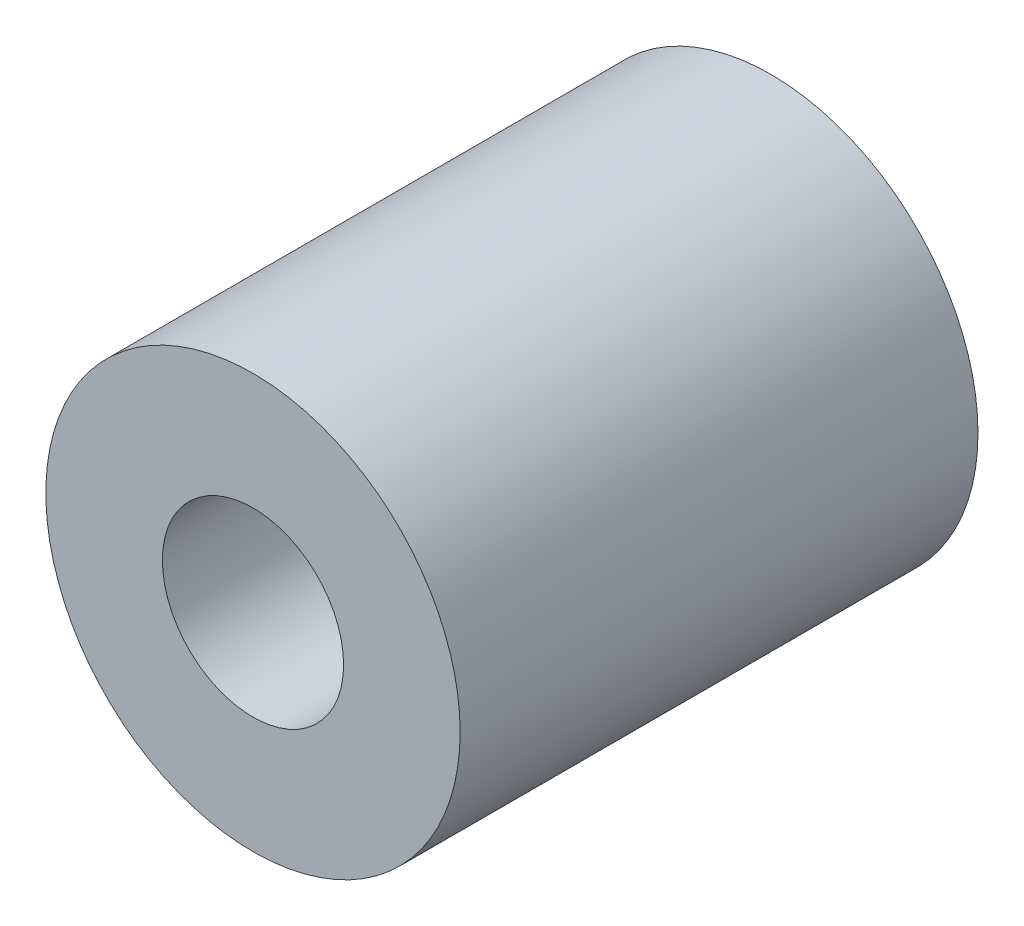
from build123d import *

# Parameters (mm, degrees)
SKETCH1_R           = 4
SKETCH1_R_2         = 1.75
BOSS_EXTRUDE1_DEPTH = 10


with BuildPart() as part:
    # Sketch1 → Boss-Extrude1 (new body)
    with BuildSketch(Plane.XY):
        Circle(SKETCH1_R)
        Circle(SKETCH1_R_2, mode=Mode.SUBTRACT)
    extrude(amount=BOSS_EXTRUDE1_DEPTH)


solid = part.part
